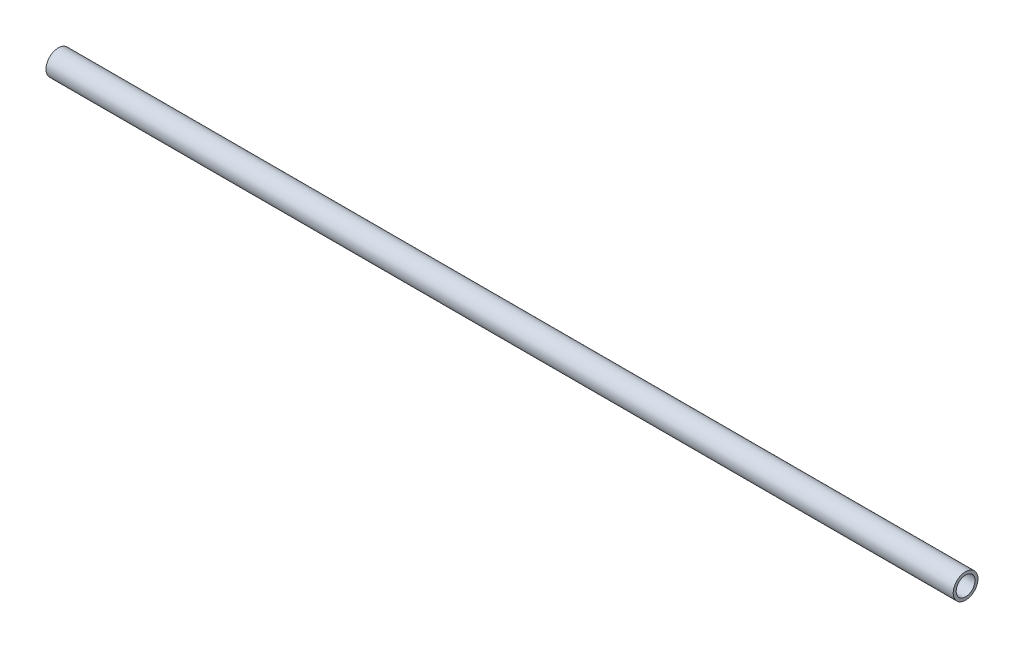
from build123d import *

# Parameters (mm, degrees)
SKETCH1_R           = 12.7
SKETCH1_R_2         = 9.652
BOSS_EXTRUDE1_DEPTH = 930


with BuildPart() as part:
    # Sketch1 → Boss-Extrude1 (new body)
    with BuildSketch(Plane(origin=(0, 0, 0), x_dir=(0, 0, -1), z_dir=(1, 0, 0))):
        Circle(SKETCH1_R)
        Circle(SKETCH1_R_2, mode=Mode.SUBTRACT)
    extrude(amount=BOSS_EXTRUDE1_DEPTH)


solid = part.part
